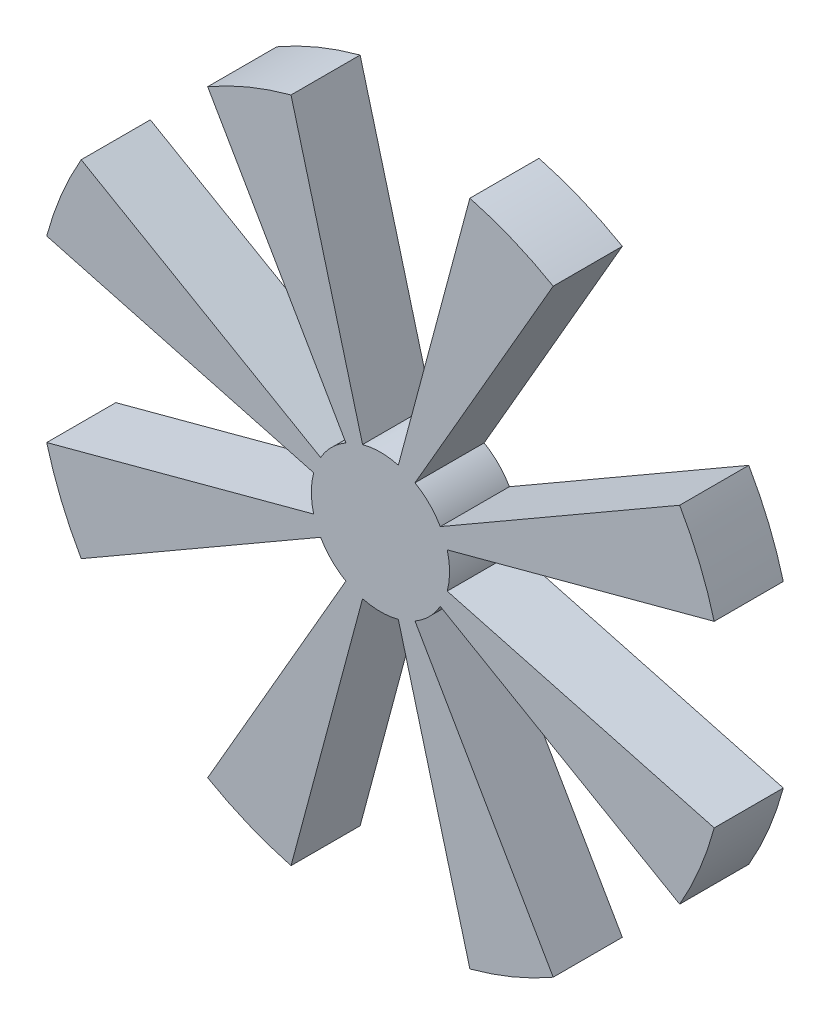
from build123d import *

# Parameters (mm, degrees)
BOSS_EXTRU_1_DEPTH           = 5
R_P_TITION_CIRCULAIRE1_COUNT = 8
ESQUISSE2_R                  = 5
BOSS_EXTRU_2_DEPTH           = 5


with BuildPart() as part:
    # Esquisse1 → Boss.-Extru.1 (new body)
    with BuildSketch(Plane.XY):
        with BuildLine():
            Line((1.294095226, 4.829629131), (6.470476128, 24.148145657))
            ThreePointArc((6.470476128, 24.148145657), (9.567085809, 23.096988313), (12.5, 21.650635095))
            Line((12.5, 21.650635095), (2.5, 4.330127019))
            ThreePointArc((2.5, 4.330127019), (1.913417162, 4.619397663), (1.294095226, 4.829629131))
        make_face()
    extrude(amount=BOSS_EXTRU_1_DEPTH)


with BuildPart() as r_p_tition_circulaire1_1:
    # Répétition circulaire1: pattern copy
    add(part.part.rotate(Axis((0, 0, 28.256111415), (0, 0, -1)), 1 * 360 / R_P_TITION_CIRCULAIRE1_COUNT))


with BuildPart() as r_p_tition_circulaire1_2:
    # Répétition circulaire1: pattern copy
    add(part.part.rotate(Axis((0, 0, 28.256111415), (0, 0, -1)), 2 * 360 / R_P_TITION_CIRCULAIRE1_COUNT))


with BuildPart() as r_p_tition_circulaire1_3:
    # Répétition circulaire1: pattern copy
    add(part.part.rotate(Axis((0, 0, 28.256111415), (0, 0, -1)), 3 * 360 / R_P_TITION_CIRCULAIRE1_COUNT))


with BuildPart() as r_p_tition_circulaire1_4:
    # Répétition circulaire1: pattern copy
    add(part.part.rotate(Axis((0, 0, 28.256111415), (0, 0, -1)), 4 * 360 / R_P_TITION_CIRCULAIRE1_COUNT))


with BuildPart() as r_p_tition_circulaire1_5:
    # Répétition circulaire1: pattern copy
    add(part.part.rotate(Axis((0, 0, 28.256111415), (0, 0, -1)), 5 * 360 / R_P_TITION_CIRCULAIRE1_COUNT))


with BuildPart() as r_p_tition_circulaire1_6:
    # Répétition circulaire1: pattern copy
    add(part.part.rotate(Axis((0, 0, 28.256111415), (0, 0, -1)), 6 * 360 / R_P_TITION_CIRCULAIRE1_COUNT))


with BuildPart() as r_p_tition_circulaire1_7:
    # Répétition circulaire1: pattern copy
    add(part.part.rotate(Axis((0, 0, 28.256111415), (0, 0, -1)), 7 * 360 / R_P_TITION_CIRCULAIRE1_COUNT))


with BuildPart() as part_1:
    add(part.part)

    add(r_p_tition_circulaire1_1.part)  # Boss.-Extru.2 merges Répétition circulaire1_1

    add(r_p_tition_circulaire1_2.part)  # Boss.-Extru.2 merges Répétition circulaire1_2

    add(r_p_tition_circulaire1_3.part)  # Boss.-Extru.2 merges Répétition circulaire1_3

    add(r_p_tition_circulaire1_4.part)  # Boss.-Extru.2 merges Répétition circulaire1_4

    add(r_p_tition_circulaire1_5.part)  # Boss.-Extru.2 merges Répétition circulaire1_5

    add(r_p_tition_circulaire1_6.part)  # Boss.-Extru.2 merges Répétition circulaire1_6

    add(r_p_tition_circulaire1_7.part)  # Boss.-Extru.2 merges Répétition circulaire1_7
    # Esquisse2 → Boss.-Extru.2 (add)
    with BuildSketch(Plane.XY):
        Circle(ESQUISSE2_R)
    extrude(amount=BOSS_EXTRU_2_DEPTH)


solid = part_1.part
